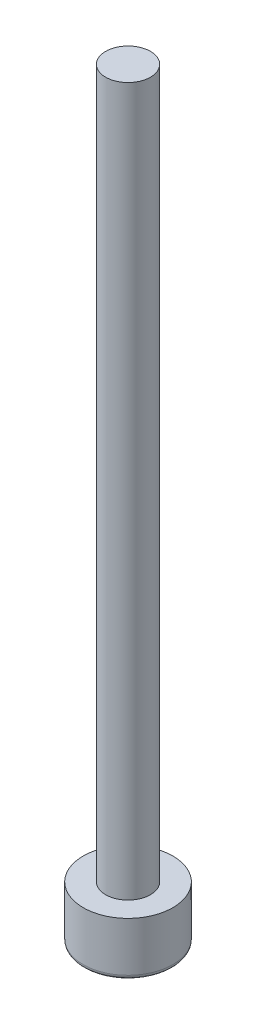
from build123d import *

# Parameters (mm, degrees)
FILLET1_R = 1


with BuildPart() as part:
    # Sketch1 → Revolve1 (revolve)
    with BuildSketch(Plane.XY, mode=Mode.PRIVATE) as revolve1_sk:
        Polygon((0, 170), (5, 170), (5, 12), (10, 12), (10, 0), (0, 0), align=None)
    revolve(revolve1_sk.sketch.rotate(Axis((0, 0, 0), (0, 1, 0)), 90), axis=Axis((0, 0, 0), (0, 1, 0)))

    # Fillet1
    fillet1_edges = [part.edges().sort_by_distance(p)[0] for p in [
        (0, 0, 10),
    ]]
    fillet(fillet1_edges, radius=FILLET1_R)


solid = part.part
